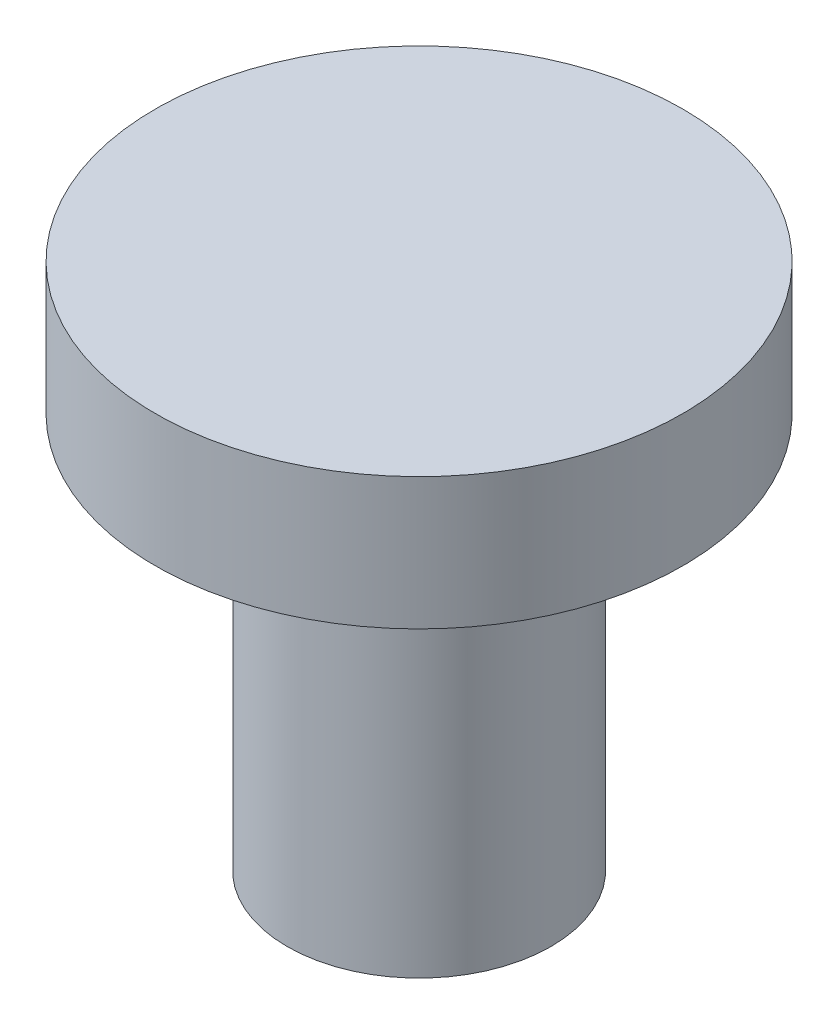
from build123d import *


with BuildPart() as part:
    # Sketch4 → Revolve1 (revolve)
    with BuildSketch(Plane.XY):
        Polygon((0, 0), (0, 4), (2, 4), (2, 3), (1, 3), (1, 0), align=None)
    revolve(axis=Axis((0, 0, 0), (0, 1, 0)))


solid = part.part
